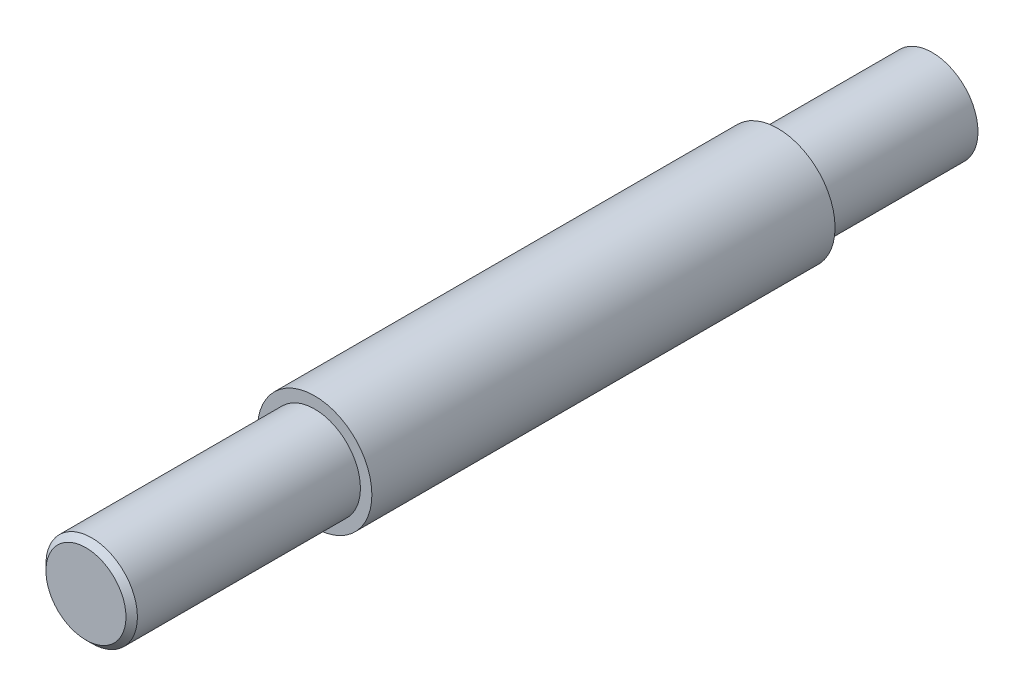
from build123d import *

# Parameters (mm, degrees)
CROQUIS1_R              = 8
SALIENTE_EXTRUIR1_DEPTH = 27
CROQUIS2_R              = 10
SALIENTE_EXTRUIR2_DEPTH = 81
CROQUIS3_R              = 8
SALIENTE_EXTRUIR3_DEPTH = 40
CHAFL_N1_SIZE           = 1
CROQUIS4_R              = 4
CORTAR_EXTRUIR1_DEPTH   = 25


with BuildPart() as part:
    # Croquis1 → Saliente-Extruir1 (new body)
    with BuildSketch(Plane.XY):
        Circle(CROQUIS1_R)
    extrude(amount=SALIENTE_EXTRUIR1_DEPTH)

    # Croquis2 → Saliente-Extruir2 (add)
    with BuildSketch(Plane.XY.offset(27)):
        Circle(CROQUIS2_R)
    extrude(amount=SALIENTE_EXTRUIR2_DEPTH)

    # Croquis3 → Saliente-Extruir3 (add)
    with BuildSketch(Plane.XY.offset(108)):
        Circle(CROQUIS3_R)
    extrude(amount=SALIENTE_EXTRUIR3_DEPTH)

    # Chaflán1
    chafl_n1_edges = [part.edges().sort_by_distance(p)[0] for p in [
        (-8, 0, 148),
    ]]
    chamfer(chafl_n1_edges, length=CHAFL_N1_SIZE)

    # Croquis4 → Cortar-Extruir1 (cut)
    with BuildSketch(Plane(origin=(0, 0, 0), x_dir=(-1, 0, 0), z_dir=(0, 0, -1))):
        Circle(CROQUIS4_R)
    extrude(amount=-CORTAR_EXTRUIR1_DEPTH, mode=Mode.SUBTRACT)


solid = part.part
